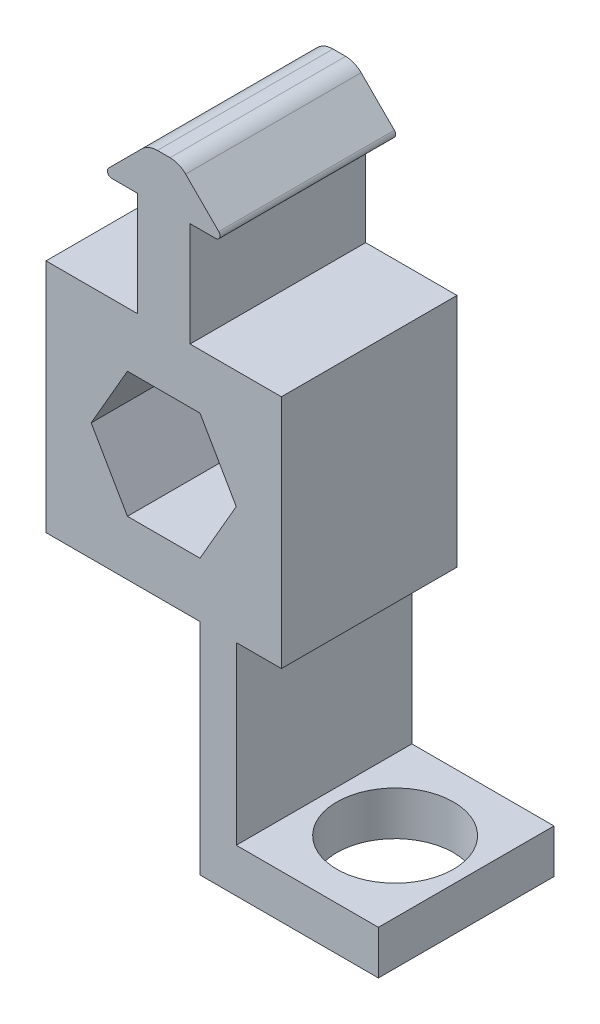
from build123d import *

# Parameters (mm, degrees)
BOSS_EXTRUDE1_DEPTH = 10.16
SKETCH3_W           = 4.197769469
SKETCH3_H           = 20.32
BOSS_EXTRUDE2_DEPTH = 25.4
SKETCH4_W           = 16.450422122
SKETCH4_H           = 20.32
SKETCH4_R           = 6.75
BOSS_EXTRUDE3_DEPTH = 5.08


with BuildPart() as part:
    # Sketch1 → Boss-Extrude1 (new, symmetric)
    with BuildSketch(Plane.XY):
        with BuildLine():
            Line((-13.62075, 13.62075), (-13.62075, -13.62075))
            Line((-13.62075, -13.62075), (13.62075, -13.62075))
            Line((13.62075, -13.62075), (13.62075, 13.62075))
            Line((13.62075, 13.62075), (3.048, 13.62075))
            Line((3.048, 13.62075), (3.048, 25.68575))
            Line((3.048, 25.68575), (6.01257951, 25.68575))
            ThreePointArc((6.01257951, 25.68575), (6.481910313, 25.999346816), (6.371789755, 26.552960245))
            Line((6.371789755, 26.552960245), (2.532108776, 30.392641224))
            ThreePointArc((2.532108776, 30.392641224), (1.70807347, 30.943244013), (0.736057552, 31.13659))
            Line((0.736057552, 31.13659), (-0.736057552, 31.13659))
            ThreePointArc((-0.736057552, 31.13659), (-1.70807347, 30.943244013), (-2.532108776, 30.392641224))
            Line((-2.532108776, 30.392641224), (-6.371789755, 26.552960245))
            ThreePointArc((-6.371789755, 26.552960245), (-6.481910313, 25.999346816), (-6.01257951, 25.68575))
            Line((-6.01257951, 25.68575), (-3.048, 25.68575))
            Line((-3.048, 25.68575), (-3.048, 13.62075))
            Line((-3.048, 13.62075), (-13.62075, 13.62075))
        make_face()
        Polygon((-4.19776947, 7.27075), (-8.395538939, 0), (-4.19776947, -7.27075), (4.19776947, -7.27075), (8.395538939, 0), (4.19776947, 7.27075), align=None, mode=Mode.SUBTRACT)
    extrude(amount=BOSS_EXTRUDE1_DEPTH, both=True)

    # Sketch3 → Boss-Extrude2 (add)
    with BuildSketch(Plane.XZ.offset(13.62075)):
        with Locations((6.296654204, 0)):
            Rectangle(SKETCH3_W, SKETCH3_H)
    extrude(amount=BOSS_EXTRUDE2_DEPTH)

    # Sketch4 → Boss-Extrude3 (add)
    with BuildSketch(Plane.XZ.offset(39.02075)):
        with Locations((16.62075, 0)):
            Rectangle(SKETCH4_W, SKETCH4_H)
        with Locations(Location((16.62075, 0, 0), (0, 0, 270))):
            Circle(SKETCH4_R, mode=Mode.SUBTRACT)
    extrude(amount=-BOSS_EXTRUDE3_DEPTH)


solid = part.part
